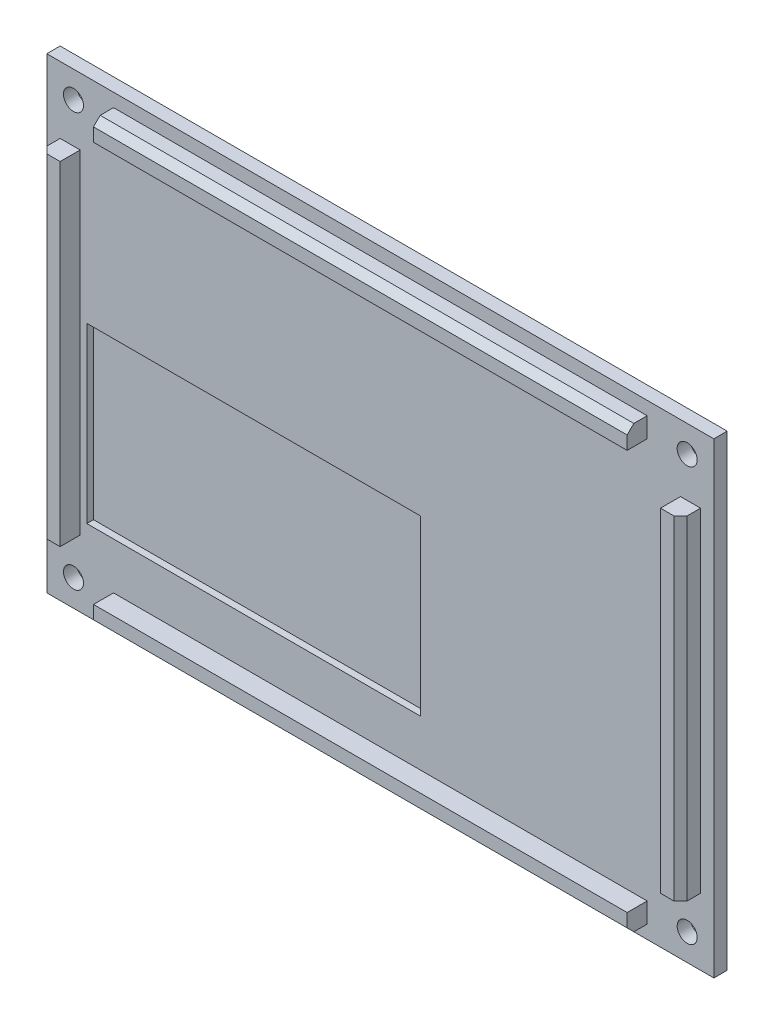
from build123d import *

# Parameters (mm, degrees)
SKIZZE1_W                       = 100
SKIZZE1_H                       = 70
AUFSATZ_LINEAR_AUSTRAGEN1_DEPTH = 2
SKIZZE2_W                       = 80
SKIZZE2_H                       = 3
SKIZZE2_W_2                     = 3
SKIZZE2_H_2                     = 50
AUFSATZ_LINEAR_AUSTRAGEN2_DEPTH = 3
FASE1_SIZE                      = 1
SKIZZE3_R                       = 1.5
SCHNITT_LINEAR_AUSTRAGEN1_DEPTH = 123.102416029
SKIZZE4_W                       = 50
SKIZZE4_H                       = 26
SCHNITT_LINEAR_AUSTRAGEN2_DEPTH = 0.01
SKIZZE6_W                       = 50
SKIZZE6_H                       = 26
SCHNITT_LINEAR_AUSTRAGEN3_DEPTH = 1


with BuildPart() as part:
    # Skizze1 → Aufsatz-Linear austragen1 (new body)
    with BuildSketch(Plane.XY):
        with Locations((50, -35)):
            Rectangle(SKIZZE1_W, SKIZZE1_H)
    extrude(amount=AUFSATZ_LINEAR_AUSTRAGEN1_DEPTH)

    # Skizze2 → Aufsatz-Linear austragen2 (add)
    with BuildSketch(Plane.XY.offset(2)):
        with Locations((50, -3.5)):
            Rectangle(SKIZZE2_W, SKIZZE2_H)
        with Locations((50, -66.5)):
            Rectangle(SKIZZE2_W, SKIZZE2_H)
        with Locations((96.5, -35)):
            Rectangle(SKIZZE2_W_2, SKIZZE2_H_2)
        with Locations((3.5, -35)):
            Rectangle(SKIZZE2_W_2, SKIZZE2_H_2)
    extrude(amount=AUFSATZ_LINEAR_AUSTRAGEN2_DEPTH)

    # Fase1
    fase1_edges = [part.edges().sort_by_distance(p)[0] for p in [
        (50, -2, 5),
        (50, -68, 5),
        (98, -35, 5),
        (2, -35, 5),
    ]]
    chamfer(fase1_edges, length=FASE1_SIZE)

    # Skizze3 → Schnitt-Linear austragen1 (cut, through all)
    with BuildSketch(Plane.XY.offset(2)):
        with Locations((4, -4)):
            Circle(SKIZZE3_R)
        with Locations((96, -4)):
            Circle(SKIZZE3_R)
        with Locations((96, -66)):
            Circle(SKIZZE3_R)
        with Locations((4, -66)):
            Circle(SKIZZE3_R)
    extrude(amount=-SCHNITT_LINEAR_AUSTRAGEN1_DEPTH, mode=Mode.SUBTRACT)

    # Skizze4 → Schnitt-Linear austragen2 (cut)
    with BuildSketch(Plane(origin=(0, 0, 0), x_dir=(-1, 0, 0), z_dir=(0, 0, -1))):
        with Locations((-31, -45)):
            Rectangle(SKIZZE4_W, SKIZZE4_H)
    extrude(amount=-SCHNITT_LINEAR_AUSTRAGEN2_DEPTH, mode=Mode.SUBTRACT)

    # Skizze6 → Schnitt-Linear austragen3 (cut)
    with BuildSketch(Plane.XY.offset(2)):
        with Locations((31, -45)):
            Rectangle(SKIZZE6_W, SKIZZE6_H)
    extrude(amount=-SCHNITT_LINEAR_AUSTRAGEN3_DEPTH, mode=Mode.SUBTRACT)


solid = part.part
